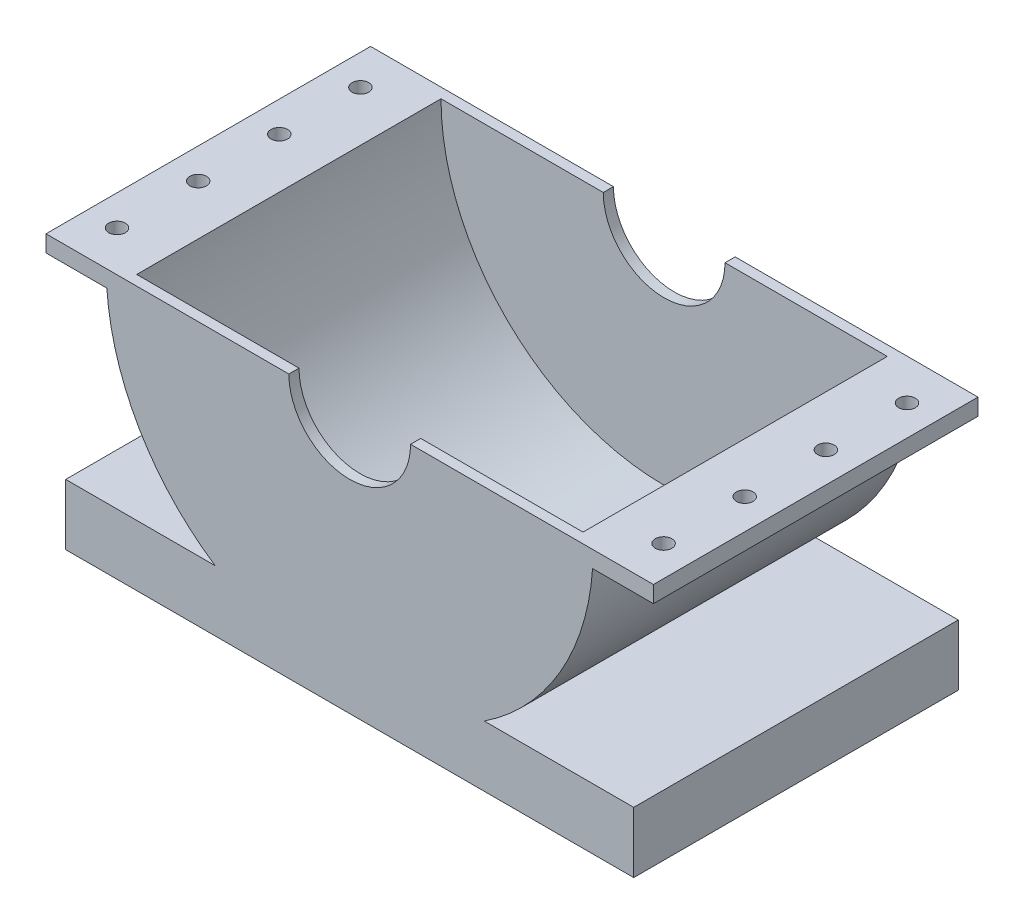
from build123d import *

# Parameters (mm, degrees)
BOSS_EXTRUDE1_DEPTH        = 4
CUT_EXTRUDE1_DEPTH         = 3.75
CUT_EXTRUDE1_DEPTH_BACK    = 3.75
SKETCH2_R                  = 5.5
F_1_0MM_DOWEL_HOLE1_REACH  = 12.691
F_1_0MM_DOWEL_HOLE1_BORE_R = 0.205
LPATTERN1_COUNT            = 4
LPATTERN1_PITCH            = 2
MIRROR1_COPY_1_REACH       = 12.691
MIRROR1_COPY_1_SKETCH_R    = 0.205
MIRROR1_COPY_2_REACH       = 12.691
MIRROR1_COPY_2_SKETCH_R    = 0.205
MIRROR1_COPY_3_REACH       = 12.691
MIRROR1_COPY_3_SKETCH_R    = 0.205


with BuildPart() as part:
    # Sketch1 → Boss-Extrude1 (new, symmetric)
    with BuildSketch(Plane.XY):
        with BuildLine():
            Line((-1.5, 0), (-7.485975276, 0))
            Line((-7.485975276, 0), (-7.485975276, -0.41))
            Line((-7.485975276, -0.41), (-5.985975276, -0.41))
            ThreePointArc((-5.985975276, -0.41), (-5.186676874, -3.016352599), (-3.31662479, -5))
            Line((-3.31662479, -5), (-7, -5))
            Line((-7, -5), (-7, -6.5))
            Line((-7, -6.5), (7, -6.5))
            Line((7, -6.5), (7, -5))
            Line((7, -5), (3.31662479, -5))
            ThreePointArc((3.31662479, -5), (5.186676874, -3.016352599), (5.985975276, -0.41))
            Line((5.985975276, -0.41), (7.485975276, -0.41))
            Line((7.485975276, -0.41), (7.485975276, 0))
            Line((7.485975276, 0), (1.5, 0))
            ThreePointArc((1.5, 0), (0, -1.5), (-1.5, 0))
        make_face()
    extrude(amount=BOSS_EXTRUDE1_DEPTH, both=True)

    # Sketch2 → Cut-Extrude1 (cut, two sides: drawn at the far end of the back side and taken through both)
    with BuildSketch(Plane.XY.offset(-CUT_EXTRUDE1_DEPTH_BACK)):
        Circle(SKETCH2_R)
    extrude(amount=CUT_EXTRUDE1_DEPTH + CUT_EXTRUDE1_DEPTH_BACK, mode=Mode.SUBTRACT)

    # Ø1.0mm Dowel Hole1 bore → Ø1.0mm Dowel Hole1 (cut, up to next)
    with BuildSketch(Plane(origin=(0, 0, 0), x_dir=(1, 0, 0), z_dir=(0, 1, 0)), mode=Mode.PRIVATE) as f_1_0mm_dowel_hole1_sk1:
        with Locations((6.735975276, 3)):
            Circle(F_1_0MM_DOWEL_HOLE1_BORE_R)
    f_1_0mm_dowel_hole1_tool1 = extrude(f_1_0mm_dowel_hole1_sk1.sketch, amount=-F_1_0MM_DOWEL_HOLE1_REACH, mode=Mode.PRIVATE) & part.part
    f_1_0mm_dowel_hole1 = f_1_0mm_dowel_hole1_tool1.solids().sort_by_distance((6.735975, 0, -3))[0]
    add(f_1_0mm_dowel_hole1, mode=Mode.SUBTRACT)

    # LPattern1: Ø1.0mm Dowel Hole1 ×4
    with Locations(*[(0, 0, i * LPATTERN1_PITCH) for i in range(1, LPATTERN1_COUNT)]):
        add(f_1_0mm_dowel_hole1, mode=Mode.SUBTRACT)

    # Mirror1: Ø1.0mm Dowel Hole1 across plane
    add(f_1_0mm_dowel_hole1.mirror(Plane(origin=(0, 0, 0), x_dir=(0, 0, 1), z_dir=(1, 0, 0))), mode=Mode.SUBTRACT)

    # Mirror1 copy 1 sketch → Mirror1 copy 1 (cut, up to next)
    with BuildSketch(Plane(origin=(0, 0, 2), x_dir=(-1, 0, 0), z_dir=(0, 1, 0)), mode=Mode.PRIVATE) as mirror1_copy_1_sk1:
        with Locations((6.735975276, -3)):
            Circle(MIRROR1_COPY_1_SKETCH_R)
    mirror1_copy_1_tool1 = extrude(mirror1_copy_1_sk1.sketch, amount=-MIRROR1_COPY_1_REACH, mode=Mode.PRIVATE) & part.part
    add(mirror1_copy_1_tool1.solids().sort_by_distance((-6.735975, 0, -1))[0], mode=Mode.SUBTRACT)

    # Mirror1 copy 2 sketch → Mirror1 copy 2 (cut, up to next)
    with BuildSketch(Plane(origin=(0, 0, 4), x_dir=(-1, 0, 0), z_dir=(0, 1, 0)), mode=Mode.PRIVATE) as mirror1_copy_2_sk1:
        with Locations((6.735975276, -3)):
            Circle(MIRROR1_COPY_2_SKETCH_R)
    mirror1_copy_2_tool1 = extrude(mirror1_copy_2_sk1.sketch, amount=-MIRROR1_COPY_2_REACH, mode=Mode.PRIVATE) & part.part
    add(mirror1_copy_2_tool1.solids().sort_by_distance((-6.735975, 0, 1))[0], mode=Mode.SUBTRACT)

    # Mirror1 copy 3 sketch → Mirror1 copy 3 (cut, up to next)
    with BuildSketch(Plane(origin=(0, 0, 6), x_dir=(-1, 0, 0), z_dir=(0, 1, 0)), mode=Mode.PRIVATE) as mirror1_copy_3_sk1:
        with Locations((6.735975276, -3)):
            Circle(MIRROR1_COPY_3_SKETCH_R)
    mirror1_copy_3_tool1 = extrude(mirror1_copy_3_sk1.sketch, amount=-MIRROR1_COPY_3_REACH, mode=Mode.PRIVATE) & part.part
    add(mirror1_copy_3_tool1.solids().sort_by_distance((-6.735975, 0, 3))[0], mode=Mode.SUBTRACT)


solid = part.part
